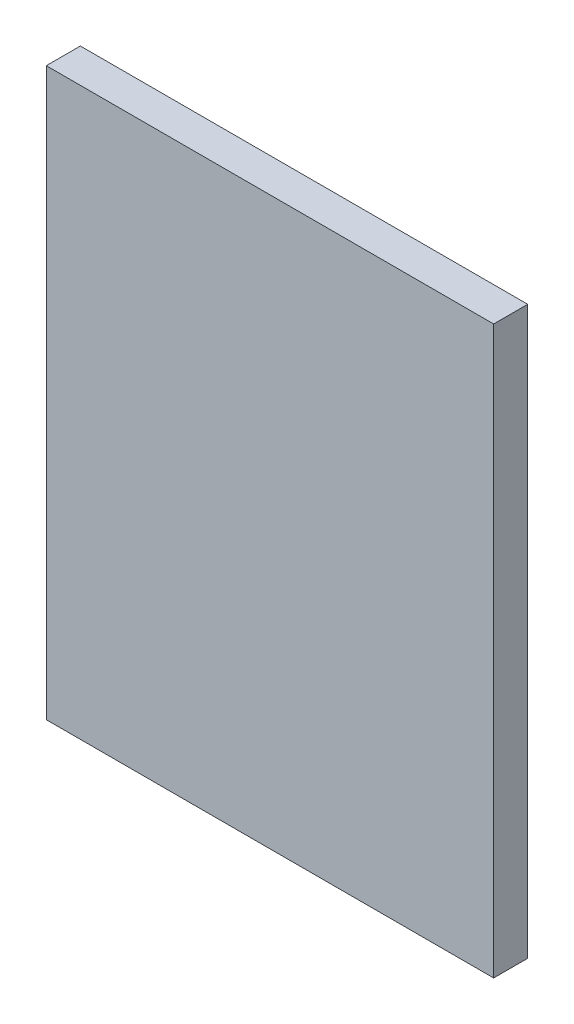
from build123d import *

# Parameters (mm, degrees)
ESQUISSE1_W             = 13.1318
ESQUISSE1_H             = 16.625597
COMPONENT_OUTLINE_DEPTH = 1


with BuildPart() as part:
    # Esquisse1 → Component_Outline (new body)
    with BuildSketch(Plane.XY):
        with Locations((0.1397, -0.9328015)):
            Rectangle(ESQUISSE1_W, ESQUISSE1_H)
    extrude(amount=COMPONENT_OUTLINE_DEPTH)


solid = part.part
